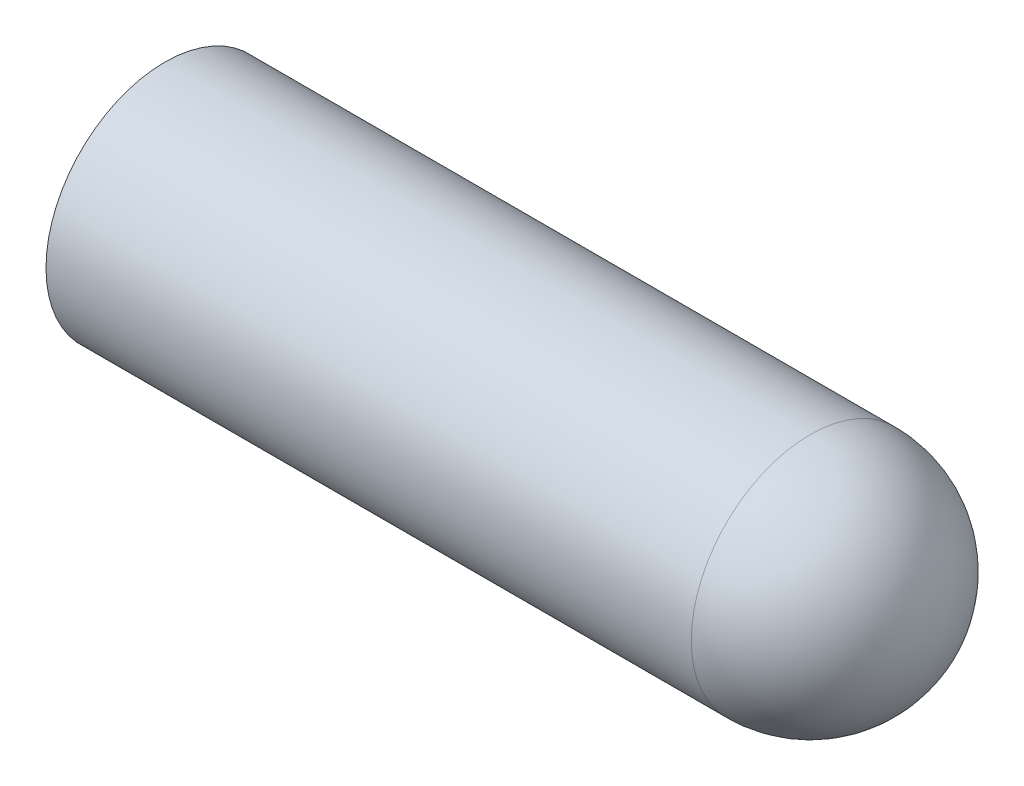
from build123d import *

# Parameters (mm, degrees)
CROQUIS3_R            = 1.6
CORTAR_EXTRUIR1_DEPTH = 6


with BuildPart() as part:
    # Croquis2 → Revolución1 (revolve)
    with BuildSketch(Plane.XY):
        with BuildLine():
            Line((0, 0), (38, 0))
            Line((38, 0), (45, 0))
            ThreePointArc((45, 0), (42.949747468, 4.949747468), (38, 7))
            Line((38, 7), (0, 7))
            Line((0, 7), (0, 0))
        make_face()
    revolve(axis=Axis((0, 0, 0), (1, 0, 0)))

    # Croquis3 → Cortar-Extruir1 (cut)
    with BuildSketch(Plane.ZY):
        Circle(CROQUIS3_R)
    extrude(amount=-CORTAR_EXTRUIR1_DEPTH, mode=Mode.SUBTRACT)


solid = part.part
